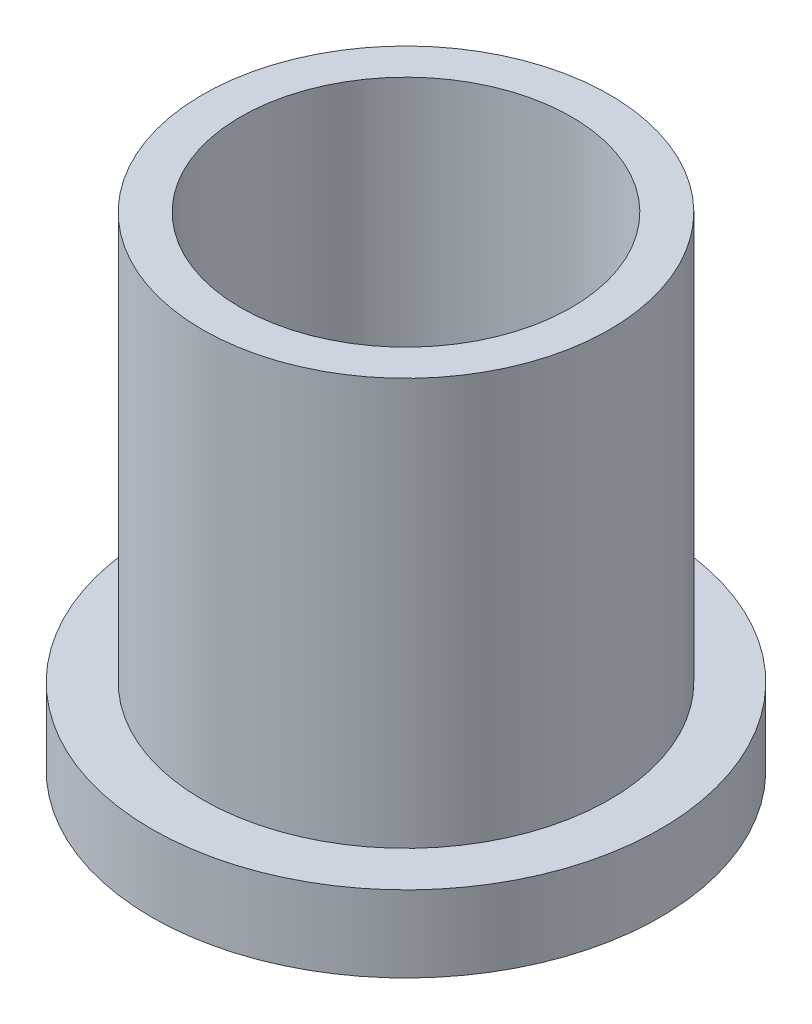
from build123d import *

# Parameters (mm, degrees)
SKETCH_1_R      = 10
SKETCH_1_R_2    = 6.5
EXTRUDE_1_DEPTH = 3
SKETCH_2_R      = 8
SKETCH_2_R_2    = 6.5
EXTRUDE_2_DEPTH = 16


with BuildPart() as part:
    # Эскиз1 → Бобышка-Вытянуть1 (new body)
    with BuildSketch(Plane(origin=(0, 0, 0), x_dir=(1, 0, 0), z_dir=(0, 1, 0))):
        with Locations(Location((0, 0, 0), (0, 0, 270))):
            Circle(SKETCH_1_R)
        with Locations(Location((0, 0, 0), (0, 0, 270))):
            Circle(SKETCH_1_R_2, mode=Mode.SUBTRACT)
    extrude(amount=EXTRUDE_1_DEPTH)

    # Эскиз2 → Бобышка-Вытянуть2 (add)
    with BuildSketch(Plane(origin=(0, 3, 0), x_dir=(1, 0, 0), z_dir=(0, 1, 0))):
        with Locations(Location((0, 0, 0), (0, 0, 270))):
            Circle(SKETCH_2_R)
        with Locations(Location((0, 0, 0), (0, 0, 270))):
            Circle(SKETCH_2_R_2, mode=Mode.SUBTRACT)
    extrude(amount=EXTRUDE_2_DEPTH)


solid = part.part
